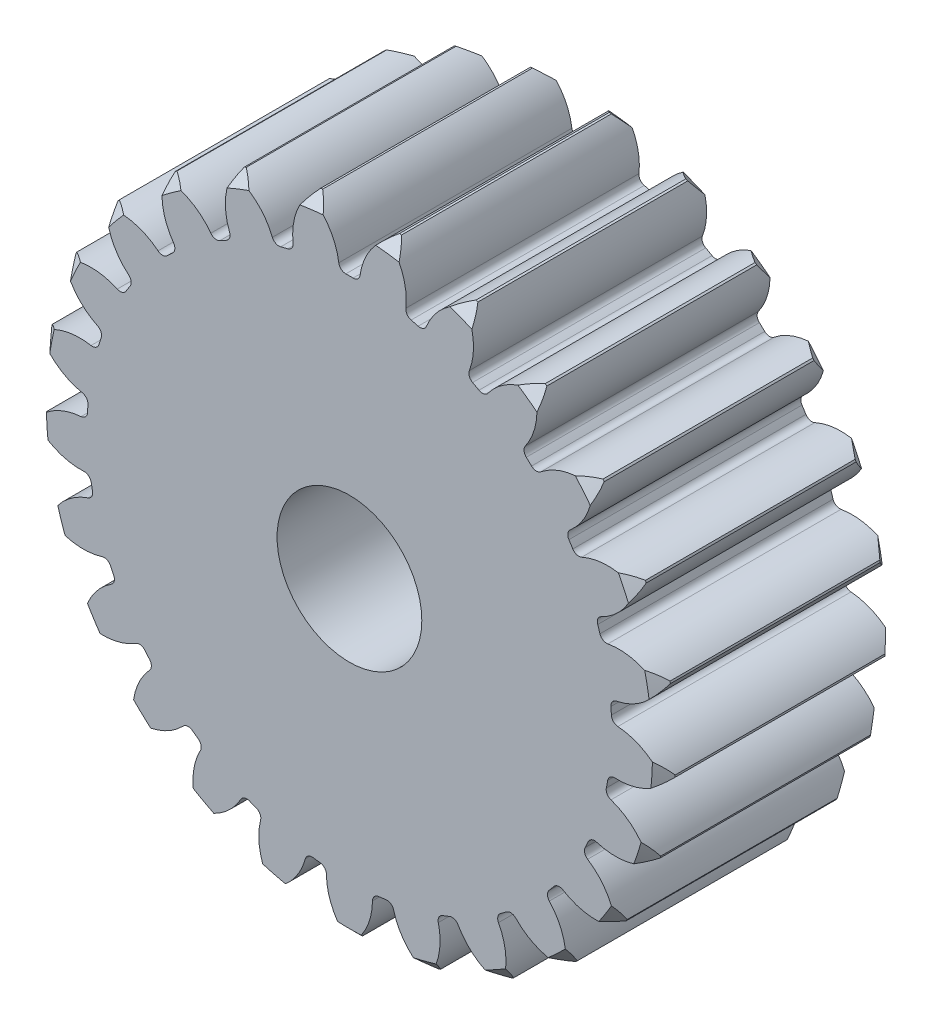
from build123d import *

# Parameters (mm, degrees)
SKETCH2_R                = 27
BOSS_EXTRUDE2_DEPTH      = 10
CHAMFER1_SIZE            = 1
CUT_EXTRUDE1_DEPTH       = 10
FILLET1_R                = 0.6
CIRPATTERN1_COUNT        = 25
FILLET1_OF_CIRPATTERN1_R = 0.6
CUT_EXTRUDE2_DEPTH       = 40.438813584
CUT_EXTRUDE2_DEPTH_BACK  = 40.438813584
SKETCH5_R                = 6.208810982


with BuildPart() as part:
    # Sketch2 → Boss-Extrude2 (new, symmetric)
    with BuildSketch(Plane.XY):
        Circle(SKETCH2_R)
    extrude(amount=BOSS_EXTRUDE2_DEPTH, both=True)

    # Chamfer1
    chamfer1_edges = [part.edges().sort_by_distance(p)[0] for p in [
        (-27, 0, -10),
        (-27, 0, 10),
    ]]
    chamfer(chamfer1_edges, length=CHAMFER1_SIZE)

    # Sketch3 → Cut-Extrude1 (cut, symmetric)
    with BuildSketch(Plane.XY):
        with BuildLine():
            ThreePointArc((-3.295408391, 26.798139554), (-1.560305885, 24.933931346), (-0.867388494, 22.48327461))
            ThreePointArc((-0.867388494, 22.48327461), (0, 22.5), (0.867388494, 22.48327461))
            ThreePointArc((0.867388494, 22.48327461), (1.560305885, 24.933931346), (3.295408391, 26.798139554))
            ThreePointArc((3.295408391, 26.798139554), (0, 27), (-3.295408391, 26.798139554))
        make_face()
    cut_extrude1 = extrude(amount=CUT_EXTRUDE1_DEPTH, both=True, mode=Mode.SUBTRACT)

    # Fillet1
    fillet1_edges = [part.edges().sort_by_distance(p)[0] for p in [
        (0.867388494, 22.48327461, 0),
        (-0.867388494, 22.48327461, 0),
    ]]
    fillet(fillet1_edges, radius=FILLET1_R)

    # CirPattern1: Cut-Extrude1 ×25 about axis
    cirpattern1_axis = Axis((0, 0, 0), (0, 0, 1))
    for i in range(1, CIRPATTERN1_COUNT):
        add(cut_extrude1.rotate(cirpattern1_axis, i * 360 / CIRPATTERN1_COUNT), mode=Mode.SUBTRACT)

    # Fillet1 of CirPattern1
    fillet1_of_cirpattern1_edges = [part.edges().sort_by_distance(p)[0] for p in [
        (-4.751225137, 21.992631941, 0),
        (-6.431500915, 21.561210448, 0),
        (-10.071301818, 20.120111324, 0),
        (-11.591498481, 19.284376137, 0),
        (-14.758561567, 16.983370116, 0),
        (-16.023159566, 15.795833549, 0),
        (-18.518486614, 12.779501303, 0),
        (-19.448026607, 11.314780648, 0),
        (-21.11482704, 7.772649423, 0),
        (-21.650902611, 6.122778465, 0),
        (-22.384445229, 2.277413394, 0),
        (-22.493372778, 0.546059593, 0),
        (-22.247566401, -3.360920894, 0),
        (-21.922501608, -5.064970212, 0),
        (-20.712791154, -8.788076161, 0),
        (-19.974159037, -10.35774931, 0),
        (-17.876555063, -13.663044284, 0),
        (-16.770766594, -14.999712926, 0),
        (-13.917069271, -17.679513084, 0),
        (-12.513605207, -18.699189414, 0),
        (-9.083122834, -20.585113057, 0),
        (-7.470167983, -21.22372706, 0),
        (-3.678450384, -22.19727467, 0),
        (-1.957352632, -22.414699879, 0),
        (1.957352632, -22.414699879, 0),
        (3.678450384, -22.19727467, 0),
        (7.470167983, -21.22372706, 0),
        (9.083122834, -20.585113057, 0),
        (12.513605207, -18.699189414, 0),
        (13.917069271, -17.679513084, 0),
        (16.770766594, -14.999712926, 0),
        (17.876555063, -13.663044284, 0),
        (19.974159037, -10.35774931, 0),
        (20.712791154, -8.788076161, 0),
        (21.922501608, -5.064970212, 0),
        (22.247566401, -3.360920894, 0),
        (22.493372778, 0.546059593, 0),
        (22.384445229, 2.277413394, 0),
        (21.650902611, 6.122778465, 0),
        (21.11482704, 7.772649423, 0),
        (19.448026607, 11.314780648, 0),
        (18.518486614, 12.779501303, 0),
        (16.023159566, 15.795833549, 0),
        (14.758561567, 16.983370116, 0),
        (11.591498481, 19.284376137, 0),
        (10.071301818, 20.120111324, 0),
        (6.431500915, 21.561210448, 0),
        (4.751225137, 21.992631941, 0),
    ]]
    fillet(fillet1_of_cirpattern1_edges, radius=FILLET1_OF_CIRPATTERN1_R)

    # Sketch5 → Cut-Extrude2 (cut, two sides: drawn at the far end of the back side and taken through both)
    with BuildSketch(Plane.XY.offset(-CUT_EXTRUDE2_DEPTH_BACK)):
        Circle(SKETCH5_R)
    extrude(amount=CUT_EXTRUDE2_DEPTH + CUT_EXTRUDE2_DEPTH_BACK, mode=Mode.SUBTRACT)


solid = part.part
